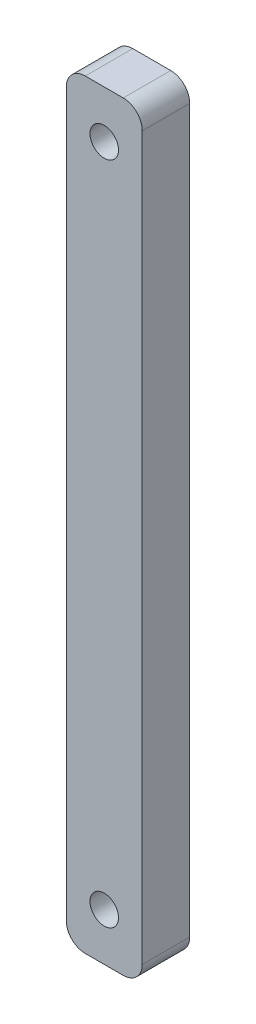
from build123d import *

# Parameters (mm, degrees)
SKETCH_1_W          = 8
SKETCH_1_H          = 80
EXTRUDE_1_DEPTH     = 5
SKETCH_2_R          = 1.5
CUT_EXTRUDE_1_DEPTH = 41.509258201
FILLET_1_R          = 2


with BuildPart() as part:
    # 草图1 → 凸台-拉伸1 (new body)
    with BuildSketch(Plane.XY):
        Rectangle(SKETCH_1_W, SKETCH_1_H)
    extrude(amount=EXTRUDE_1_DEPTH)

    # 草图2 → 切除-拉伸1 (cut, through all)
    with BuildSketch(Plane.XY.offset(5)):
        with Locations((0, 35)):
            Circle(SKETCH_2_R)
        with Locations((0, -35)):
            Circle(SKETCH_2_R)
    extrude(amount=-CUT_EXTRUDE_1_DEPTH, mode=Mode.SUBTRACT)

    # 圆角1
    fillet_1_edges = [part.edges().sort_by_distance(p)[0] for p in [
        (-4, 40, 2.5),
        (4, 40, 2.5),
        (4, -40, 2.5),
        (-4, -40, 2.5),
    ]]
    fillet(fillet_1_edges, radius=FILLET_1_R)


solid = part.part
